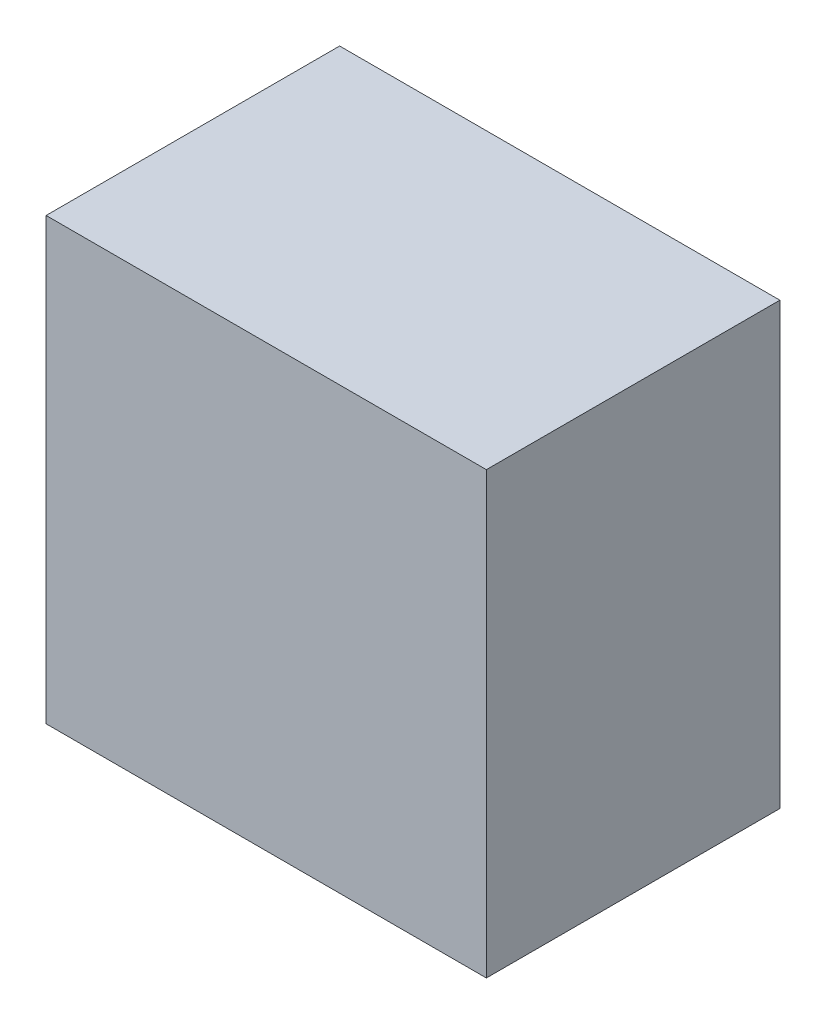
from build123d import *

# Parameters (mm, degrees)
SKETCH2_W           = 54
SKETCH2_H           = 54
BOSS_EXTRUDE1_DEPTH = 18


with BuildPart() as part:
    # Sketch2 → Boss-Extrude1 (new, symmetric)
    with BuildSketch(Plane.XY):
        Rectangle(SKETCH2_W, SKETCH2_H)
    extrude(amount=BOSS_EXTRUDE1_DEPTH, both=True)


solid = part.part
